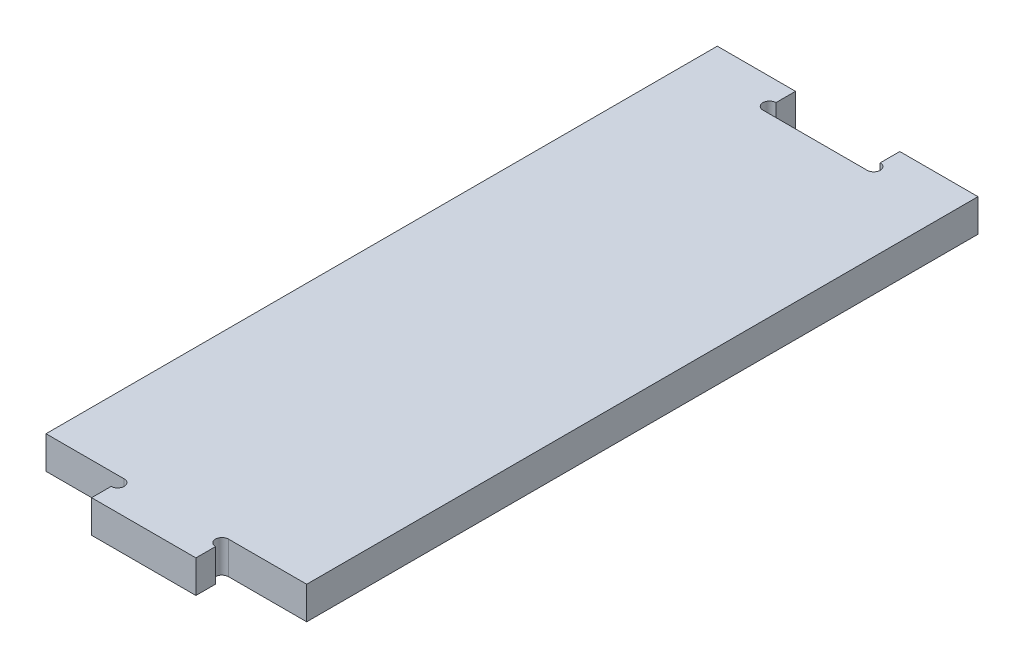
from build123d import *

# Parameters (mm, degrees)
SKETCH_1_W          = 40
SKETCH_1_H          = 103
EXTRUDE_1_DEPTH     = 5
SKETCH_2_W          = 16
SKETCH_2_H          = 5
CUT_EXTRUDE_1_DEPTH = 5
SKETCH_3_W          = 16
SKETCH_3_H          = 5
EXTRUDE_3_DEPTH     = 5
SKETCH_4_R          = 1
CUT_EXTRUDE_2_DEPTH = 10


with BuildPart() as part:
    # 스케치1 → 보스-돌출1 (new body)
    with BuildSketch(Plane(origin=(0, 0, 0), x_dir=(1, 0, 0), z_dir=(0, 1, 0))):
        with Locations((20, 51.5)):
            Rectangle(SKETCH_1_W, SKETCH_1_H)
    extrude(amount=EXTRUDE_1_DEPTH)

    # 스케치2 → 컷-돌출1 (cut)
    with BuildSketch(Plane(origin=(0, 5, 0), x_dir=(1, 0, 0), z_dir=(0, 1, 0))):
        with Locations((20, 100.5)):
            Rectangle(SKETCH_2_W, SKETCH_2_H)
    extrude(amount=-CUT_EXTRUDE_1_DEPTH, mode=Mode.SUBTRACT)

    # 스케치3 → 보스-돌출3 (add)
    with BuildSketch(Plane(origin=(0, 5, 0), x_dir=(1, 0, 0), z_dir=(0, 1, 0))):
        with Locations((20, -2.5)):
            Rectangle(SKETCH_3_W, SKETCH_3_H)
    extrude(amount=-EXTRUDE_3_DEPTH)

    # 스케치4 → 컷-돌출2 (cut)
    with BuildSketch(Plane(origin=(0, 5, 0), x_dir=(1, 0, 0), z_dir=(0, 1, 0))):
        with Locations((12, -1)):
            Circle(SKETCH_4_R)
        with Locations((28, -1)):
            Circle(SKETCH_4_R)
        with Locations((12, 99)):
            Circle(SKETCH_4_R)
        with Locations((28, 99)):
            Circle(SKETCH_4_R)
    extrude(amount=-CUT_EXTRUDE_2_DEPTH, mode=Mode.SUBTRACT)


solid = part.part
